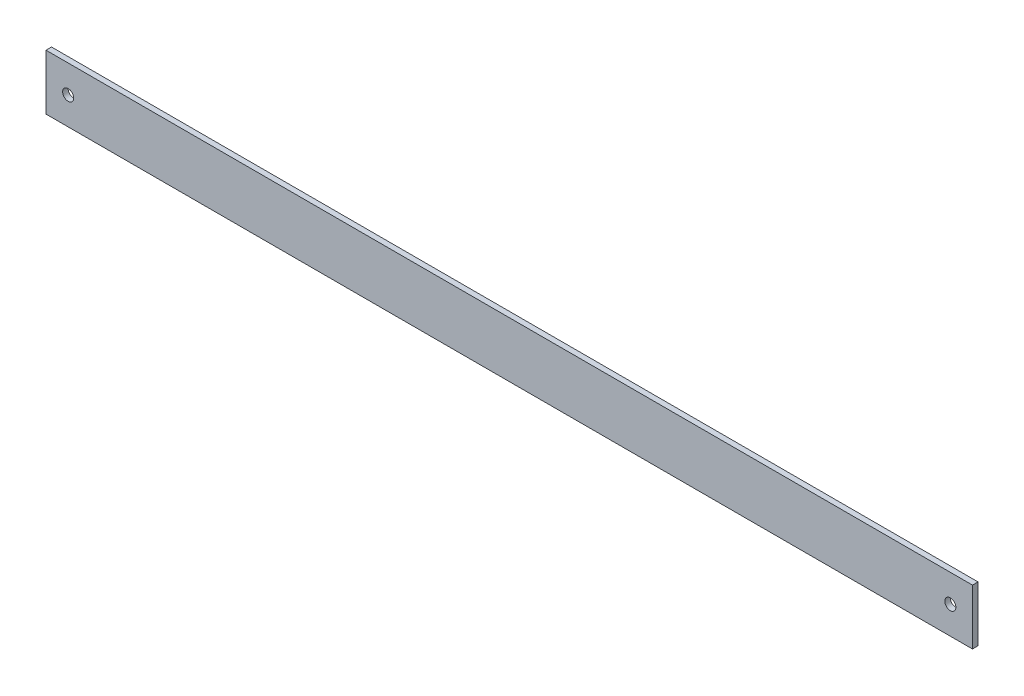
from build123d import *

# Parameters (mm, degrees)
ESQUISSE1_W      = 251
ESQUISSE1_H      = 15
EXTRUSION1_DEPTH = 1.5
ESQUISSE2_R      = 1.5
EXTRUSION2_DEPTH = 1.5


with BuildPart() as part:
    # Esquisse1 → Extrusion1 (new body)
    with BuildSketch(Plane.XY):
        with Locations((-161.409577855, 1675.531969937)):
            Rectangle(ESQUISSE1_W, ESQUISSE1_H)
    extrude(amount=EXTRUSION1_DEPTH)

    # Esquisse2 → Extrusion2 (cut)
    with BuildSketch(Plane(origin=(0, 0, 0), x_dir=(-1, 0, 0), z_dir=(0, 0, -1))):
        with Locations((280.909577855, 1675.531969937)):
            Circle(ESQUISSE2_R)
        with Locations((41.909577855, 1675.531969937)):
            Circle(ESQUISSE2_R)
    extrude(amount=-EXTRUSION2_DEPTH, mode=Mode.SUBTRACT)


solid = part.part
